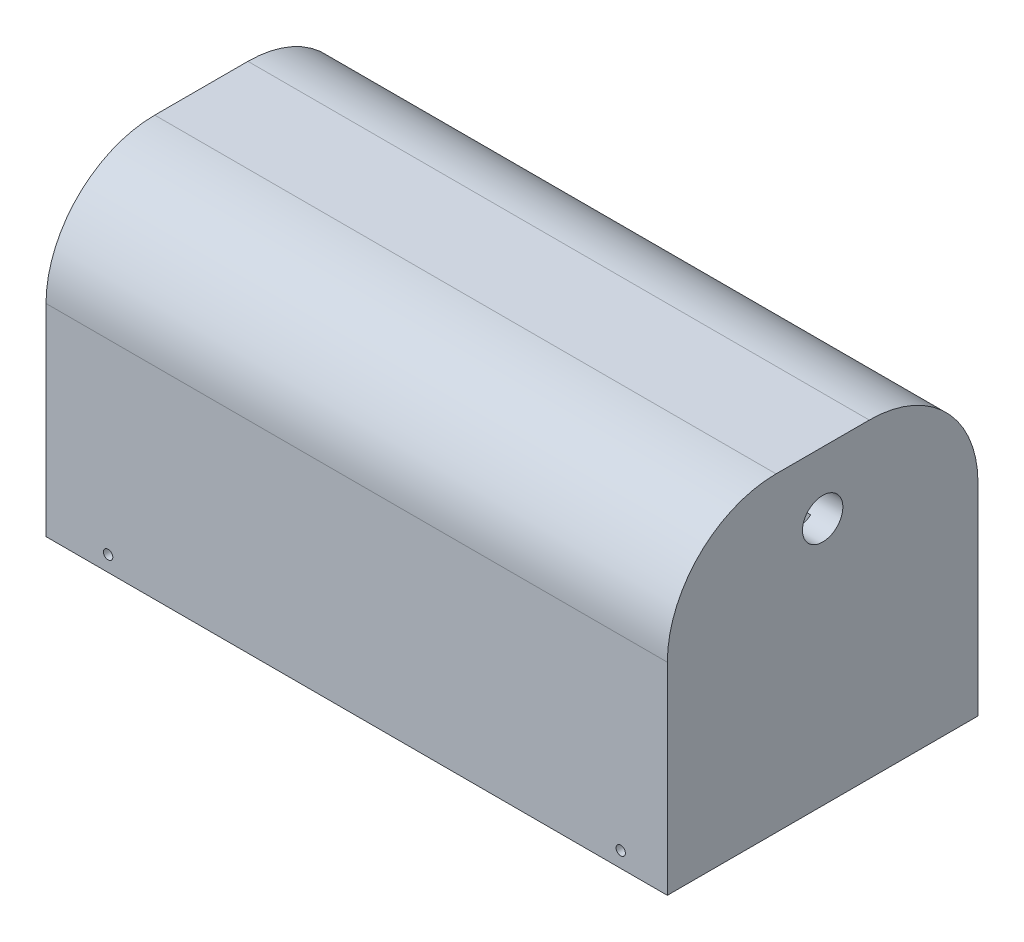
from build123d import *

# Parameters (mm, degrees)
ESQUISSE1_W             = 200
ESQUISSE1_H             = 100
BOSS_EXTRU_1_DEPTH      = 100
ESQUISSE2_R             = 6.5
ENL_V_MAT_EXTRU_1_DEPTH = 230.128784748
ESQUISSE4_R             = 1.5
ENL_V_MAT_EXTRU_3_DEPTH = 151
ESQUISSE8_W             = 184
ESQUISSE8_H             = 84
ENL_V_MAT_EXTRU_8_DEPTH = 75
ESQUISSE9_W             = 192
ESQUISSE9_H             = 92
ENL_V_MAT_EXTRU_9_DEPTH = 8
CONG_2_R                = 35


with BuildPart() as part:
    # Esquisse1 → Boss.-Extru.1 (new body)
    with BuildSketch(Plane.XY):
        Rectangle(ESQUISSE1_W, ESQUISSE1_H)
    extrude(amount=BOSS_EXTRU_1_DEPTH)

    # Esquisse2 → Enlèv. mat.-Extru.1 (cut, through all)
    with BuildSketch(Plane(origin=(100, 0, 0), x_dir=(0, 0, -1), z_dir=(1, 0, 0))):
        with Locations((-50, 30)):
            Circle(ESQUISSE2_R)
    extrude(amount=-ENL_V_MAT_EXTRU_1_DEPTH, mode=Mode.SUBTRACT)

    # Esquisse4 → Enlèv. mat.-Extru.3 (cut, through all)
    with BuildSketch(Plane.XY.offset(100)):
        with Locations((85, -45)):
            Circle(ESQUISSE4_R)
        with Locations((-80, -45)):
            Circle(ESQUISSE4_R)
    extrude(amount=-ENL_V_MAT_EXTRU_3_DEPTH, mode=Mode.SUBTRACT)

    # Esquisse8 → Enlèv. mat.-Extru.8 (cut)
    with BuildSketch(Plane.XZ.offset(50)):
        with Locations((0, 50)):
            Rectangle(ESQUISSE8_W, ESQUISSE8_H)
    extrude(amount=-ENL_V_MAT_EXTRU_8_DEPTH, mode=Mode.SUBTRACT)

    # Esquisse9 → Enlèv. mat.-Extru.9 (cut)
    with BuildSketch(Plane.XZ.offset(50)):
        with Locations((0, 50)):
            Rectangle(ESQUISSE9_W, ESQUISSE9_H)
    extrude(amount=-ENL_V_MAT_EXTRU_9_DEPTH, mode=Mode.SUBTRACT)

    # Congé2
    cong_2_edges = [part.edges().sort_by_distance(p)[0] for p in [
        (0, 50, 100),
        (0, 50, 0),
    ]]
    fillet(cong_2_edges, radius=CONG_2_R)


solid = part.part
